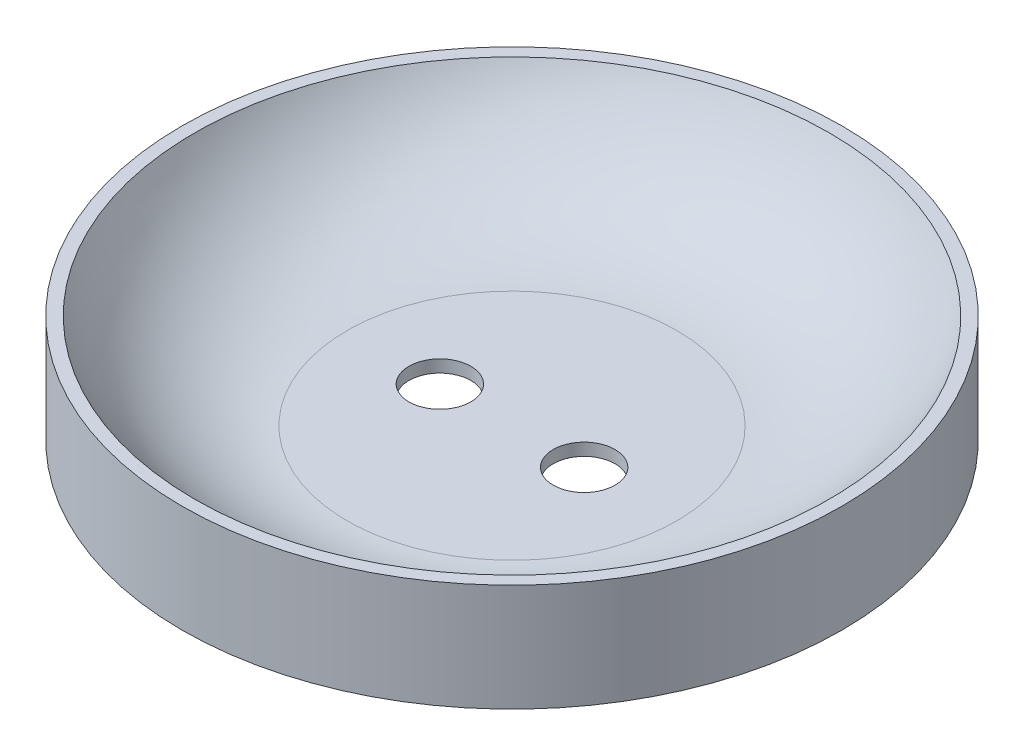
from build123d import *

# Parameters (mm, degrees)
SKETCH2_R          = 9.525
CUT_EXTRUDE1_DEPTH = 148.442344892
SKETCH3_R          = 6.35
CUT_EXTRUDE2_DEPTH = 3.81
CIRPATTERN1_COUNT  = 15
FILLET1_R          = 1.27


with BuildPart() as part:
    # Sketch1 → Revolve1 (revolve)
    with BuildSketch(Plane.XY, mode=Mode.PRIVATE) as revolve1_sk:
        with BuildLine():
            Line((0, 0), (50.8, 0))
            ThreePointArc((50.8, 0), (77.507770873, 6.756373885), (97.79, 25.4))
            Line((97.79, 25.4), (97.79, 3.81))
            Line((97.79, 3.81), (78.74, 3.81))
            Line((78.74, 3.81), (78.74, 0))
            Line((78.74, 0), (101.6, 0))
            Line((101.6, 0), (101.6, 33.077561287))
            Line((101.6, 33.077561287), (97.79, 33.077561287))
            ThreePointArc((97.79, 33.077561287), (78.479641633, 11.725205481), (50.8, 3.81))
            Line((50.8, 3.81), (0, 3.81))
            Line((0, 3.81), (0, 0))
        make_face()
    revolve(revolve1_sk.sketch.rotate(Axis((0, 0, 0), (0, 1, 0)), 90), axis=Axis((0, 0, 0), (0, 1, 0)))

    # Sketch2 → Cut-Extrude1 (cut, through all)
    with BuildSketch(Plane.XZ):
        with Locations(Location((-22.225, 0, 0), (0, 0, 270))):
            Circle(SKETCH2_R)
        with Locations(Location((22.225, 0, 0), (0, 0, 270))):
            Circle(SKETCH2_R)
    extrude(amount=-CUT_EXTRUDE1_DEPTH, mode=Mode.SUBTRACT)

    # Sketch3 → Cut-Extrude2 (cut)
    with BuildSketch(Plane.XZ):
        with Locations(Location((-88.9, 0, 0), (0, 0, 270))):
            Circle(SKETCH3_R)
    cut_extrude2 = extrude(amount=-CUT_EXTRUDE2_DEPTH, mode=Mode.SUBTRACT)

    # CirPattern1: Cut-Extrude2 ×15 about axis
    cirpattern1_axis = Axis((0, 0, 0), (0, 1, 0))
    for i in range(1, CIRPATTERN1_COUNT):
        add(cut_extrude2.rotate(cirpattern1_axis, i * 360 / CIRPATTERN1_COUNT), mode=Mode.SUBTRACT)

    # Fillet1
    fillet1_edges = [part.edges().sort_by_distance(p)[0] for p in [
        (0, 3.81, 78.74),
        (0, 3.81, 97.79),
    ]]
    fillet(fillet1_edges, radius=FILLET1_R)


solid = part.part
